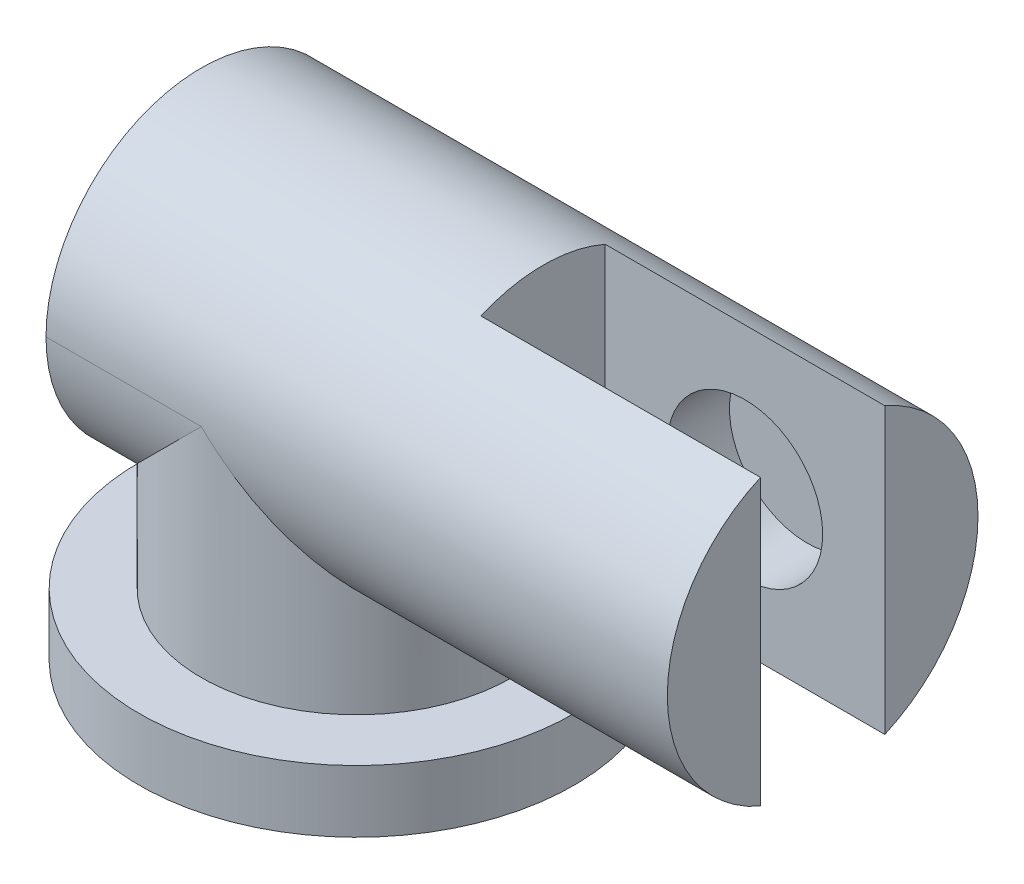
from build123d import *

# Parameters (mm, degrees)
SKETCH1_R           = 5
BOSS_EXTRUDE1_DEPTH = 10
SKETCH2_W           = 2
SKETCH2_H           = 10
CUT_EXTRUDE1_DEPTH  = 9
SKETCH3_R           = 2.5
CUT_EXTRUDE2_DEPTH  = 2
BOSS_EXTRUDE2_START = 10
SKETCH4_R           = 5
BOSS_EXTRUDE2_DEPTH = 10
SKETCH5_R           = 5
BOSS_EXTRUDE3_DEPTH = 7
SKETCH6_R           = 7
BOSS_EXTRUDE4_DEPTH = 2


with BuildPart() as part:
    # Sketch1 → Boss-Extrude1 (new body)
    with BuildSketch(Plane(origin=(0, 0, 0), x_dir=(0, 0, -1), z_dir=(1, 0, 0))):
        Circle(SKETCH1_R)
    extrude(amount=BOSS_EXTRUDE1_DEPTH)

    # Sketch2 → Cut-Extrude1 (cut)
    with BuildSketch(Plane(origin=(10, 0, 0), x_dir=(0, 0, -1), z_dir=(1, 0, 0))):
        with Locations((1, 0)):
            Rectangle(SKETCH2_W, SKETCH2_H)
    cut_extrude1 = extrude(amount=-CUT_EXTRUDE1_DEPTH, mode=Mode.SUBTRACT)

    # Sketch3 → Cut-Extrude2 (cut)
    with BuildSketch(Plane.XY.offset(-2)):
        with Locations((5.5, 0)):
            Circle(SKETCH3_R)
    cut_extrude2 = extrude(amount=-CUT_EXTRUDE2_DEPTH, mode=Mode.SUBTRACT)

    # Mirror1: Cut-Extrude1, Cut-Extrude2 across plane
    add(cut_extrude1.mirror(Plane.XY), mode=Mode.SUBTRACT)
    add(cut_extrude2.mirror(Plane.XY), mode=Mode.SUBTRACT)

    # Sketch4 → Boss-Extrude2 (add)
    with BuildSketch(Plane.ZY.offset(BOSS_EXTRUDE2_START)):
        Circle(SKETCH4_R)
    extrude(amount=-BOSS_EXTRUDE2_DEPTH)

    # Sketch5 → Boss-Extrude3 (add)
    with BuildSketch(Plane(origin=(0, 0, 0), x_dir=(1, 0, 0), z_dir=(0, 1, 0))):
        with Locations(Location((-5, 0, 0), (0, 0, 270))):
            Circle(SKETCH5_R)
    extrude(amount=-BOSS_EXTRUDE3_DEPTH)

    # Sketch6 → Boss-Extrude4 (add)
    with BuildSketch(Plane.XZ.offset(7)):
        with Locations(Location((-5, 0, 0), (0, 0, 270))):
            Circle(SKETCH6_R)
    extrude(amount=BOSS_EXTRUDE4_DEPTH)


solid = part.part
